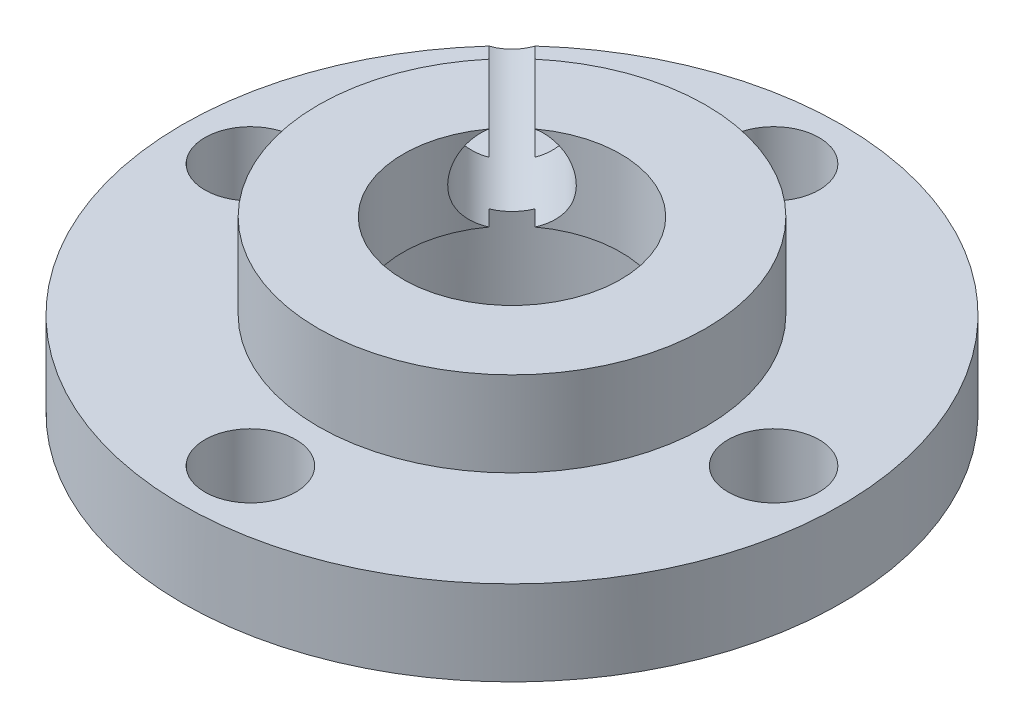
from build123d import *

# Parameters (mm, degrees)
SKETCH1_R                      = 7.239
SKETCH1_R_2                    = 4.064
BOSS_EXTRUDE1_DEPTH            = 6.35
SKETCH1_3_R                    = 12.319
SKETCH1_3_R_2                  = 7.239
BOSS_EXTRUDE2_DEPTH            = 3.175
SKETCH2_R                      = 1.7
CUT_EXTRUDE1_DEPTH             = 3.175
SKETCH7_R                      = 4.8895
CUT_EXTRUDE3_DEPTH             = 3.175
CUT_EXTRUDE2_REACH             = 27.151
SKETCH5_R                      = 1.7
CUT_EXTRUDE2_DIRECTION_2_REACH = 27.151


with BuildPart() as part:
    # Sketch1 → Boss-Extrude1 (new body)
    with BuildSketch(Plane(origin=(0, 0, 0), x_dir=(1, 0, 0), z_dir=(0, 1, 0))):
        Circle(SKETCH1_R)
        Circle(SKETCH1_R_2, mode=Mode.SUBTRACT)
    extrude(amount=BOSS_EXTRUDE1_DEPTH)

    # Sketch1<3> → Boss-Extrude2 (add)
    with BuildSketch(Plane(origin=(0, 0, 0), x_dir=(1, 0, 0), z_dir=(0, 1, 0))):
        Circle(SKETCH1_3_R)
        Circle(SKETCH1_3_R_2, mode=Mode.SUBTRACT)
    extrude(amount=BOSS_EXTRUDE2_DEPTH)

    # Sketch2 → Cut-Extrude1 (cut)
    with BuildSketch(Plane(origin=(0, 3.175, 0), x_dir=(1, 0, 0), z_dir=(0, 1, 0))):
        with Locations((0, 9.779)):
            Circle(SKETCH2_R)
        with Locations((9.779, 0)):
            Circle(SKETCH2_R)
        with Locations((0, -9.779)):
            Circle(SKETCH2_R)
        with Locations((-9.779, 0)):
            Circle(SKETCH2_R)
    extrude(amount=-CUT_EXTRUDE1_DEPTH, mode=Mode.SUBTRACT)

    # Sketch7 → Cut-Extrude3 (cut)
    with BuildSketch(Plane.XZ):
        Circle(SKETCH7_R)
    extrude(amount=-CUT_EXTRUDE3_DEPTH, mode=Mode.SUBTRACT)

    # Sketch5 → Cut-Extrude2 (cut, up to next)
    with BuildSketch(Plane(origin=(-4.8895, 0, -4.8895), x_dir=(-0.7071067811865475, 0, 0.7071067811865477), z_dir=(-0.7071067811865477, 0, -0.7071067811865475)), mode=Mode.PRIVATE) as cut_extrude2_sk1:
        with Locations((0, 4.7625)):
            Circle(SKETCH5_R)
    cut_extrude2_tool1 = extrude(cut_extrude2_sk1.sketch, amount=-CUT_EXTRUDE2_REACH, mode=Mode.PRIVATE) & part.part
    add(cut_extrude2_tool1.solids().sort_by_distance((-4.8895, 4.7625, -4.8895))[0], mode=Mode.SUBTRACT)

    # Sketch5 → Cut-Extrude2 direction 2 (cut, up to next)
    with BuildSketch(Plane(origin=(-4.8895, 0, -4.8895), x_dir=(-0.7071067811865475, 0, 0.7071067811865477), z_dir=(-0.7071067811865477, 0, -0.7071067811865475)), mode=Mode.PRIVATE) as cut_extrude2_direction_2_sk1:
        with Locations((0, 4.7625)):
            Circle(SKETCH5_R)
    cut_extrude2_direction_2_tool1 = extrude(cut_extrude2_direction_2_sk1.sketch, amount=CUT_EXTRUDE2_DIRECTION_2_REACH, mode=Mode.PRIVATE) & part.part
    add(cut_extrude2_direction_2_tool1.solids().sort_by_distance((-4.8895, 4.7625, -4.8895))[0], mode=Mode.SUBTRACT)


solid = part.part
